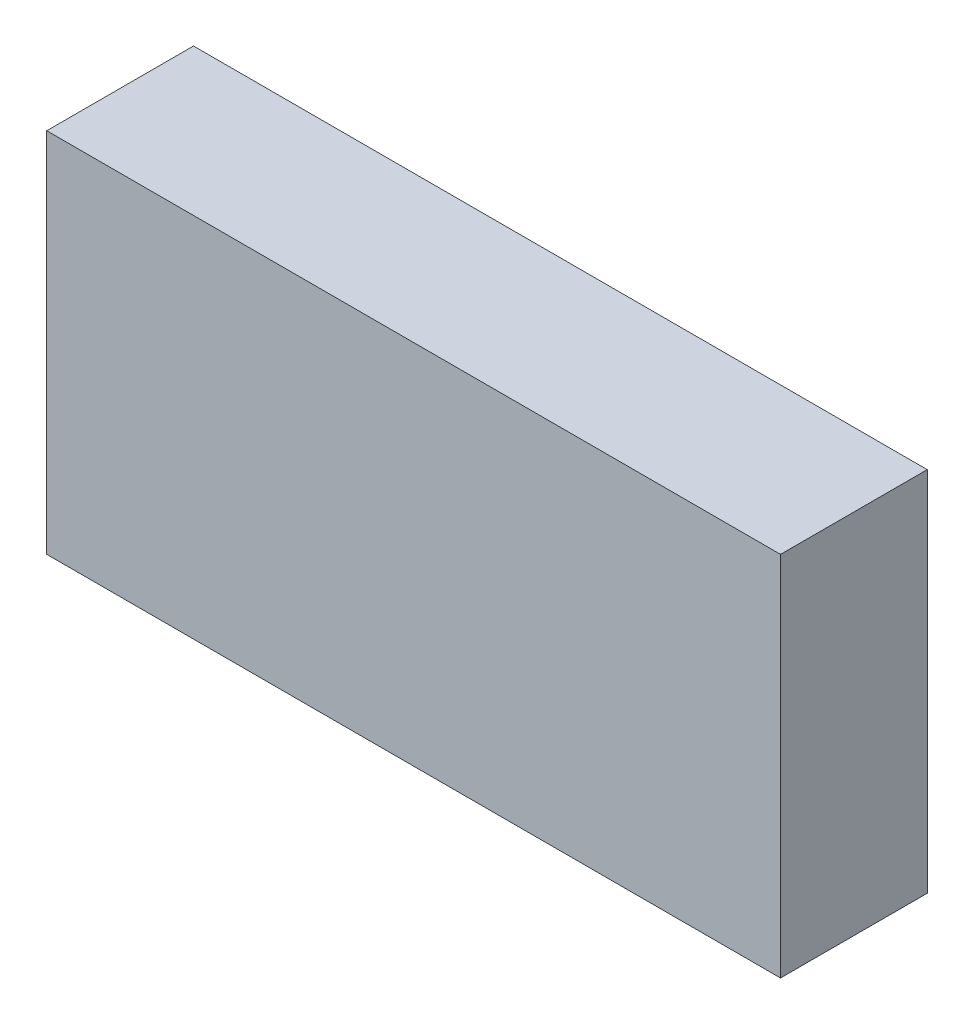
from build123d import *

# Parameters (mm, degrees)
SKETCH1_W           = 50
SKETCH1_H           = 25
BOSS_EXTRUDE1_DEPTH = 10


with BuildPart() as part:
    # Sketch1 → Boss-Extrude1 (new body)
    with BuildSketch(Plane.XY):
        with Locations((-6.627906977, 5.813953488)):
            Rectangle(SKETCH1_W, SKETCH1_H)
    extrude(amount=BOSS_EXTRUDE1_DEPTH)


solid = part.part
